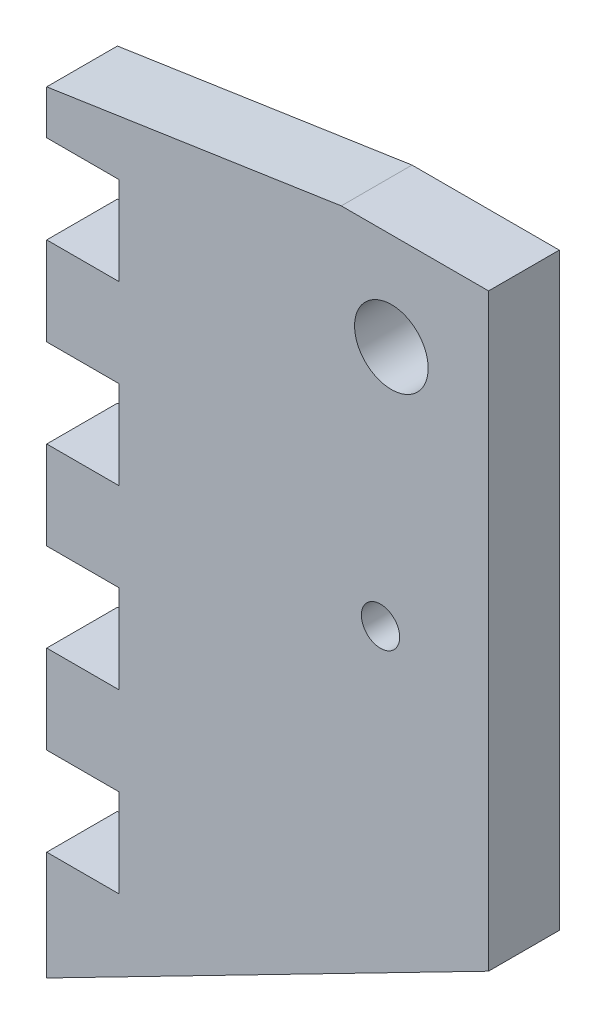
from build123d import *

# Parameters (mm, degrees)
SKETCH1_R           = 3.175
BOSS_EXTRUDE1_DEPTH = 6.096
CUT_EXTRUDE1_DEPTH  = 8.636
SKETCH4_W           = 6.223
SKETCH4_H           = 7.62
CUT_EXTRUDE2_DEPTH  = 81.243500547
SKETCH5_R           = 1.651
CUT_EXTRUDE4_DEPTH  = 6.096


with BuildPart() as part:
    # Sketch1 → Boss-Extrude1 (new body)
    with BuildSketch(Plane.XY):
        Polygon((0, 0), (-38.1, 0), (-38.1, -7.62), (-31.877, -7.62), (-31.877, -15.24), (-38.1, -15.24), (-38.1, -22.86), (-31.877, -22.86), (-31.877, -30.48), (-38.1, -30.48), (-38.1, -38.1), (-31.877, -38.1), (-31.877, -45.72), (-38.1, -45.72), (-38.1, -70.358), (0, -50.8), align=None)
        with Locations(Location((-8.382, -8.382, 0), (0, 0, 180))):
            Circle(SKETCH1_R, mode=Mode.SUBTRACT)
    extrude(amount=BOSS_EXTRUDE1_DEPTH)

    # Sketch2 → Cut-Extrude1 (cut)
    with BuildSketch(Plane(origin=(0, 0, 0), x_dir=(-1, 0, 0), z_dir=(0, 0, -1))):
        Polygon((38.1, 0), (12.7, 0), (38.1, -3.81), align=None)
    extrude(amount=-CUT_EXTRUDE1_DEPTH, mode=Mode.SUBTRACT)

    # Sketch4 → Cut-Extrude2 (cut, through all)
    with BuildSketch(Plane.XY.offset(6.096)):
        with Locations((-34.9885, -57.15)):
            Rectangle(SKETCH4_W, SKETCH4_H)
    extrude(amount=-CUT_EXTRUDE2_DEPTH, mode=Mode.SUBTRACT)

    # Sketch5 → Cut-Extrude4 (cut)
    with BuildSketch(Plane(origin=(0, 0, 0), x_dir=(-1, 0, 0), z_dir=(0, 0, -1))):
        with Locations((9.318987701, -29.697415784)):
            Circle(SKETCH5_R)
    extrude(amount=-CUT_EXTRUDE4_DEPTH, mode=Mode.SUBTRACT)


solid = part.part
